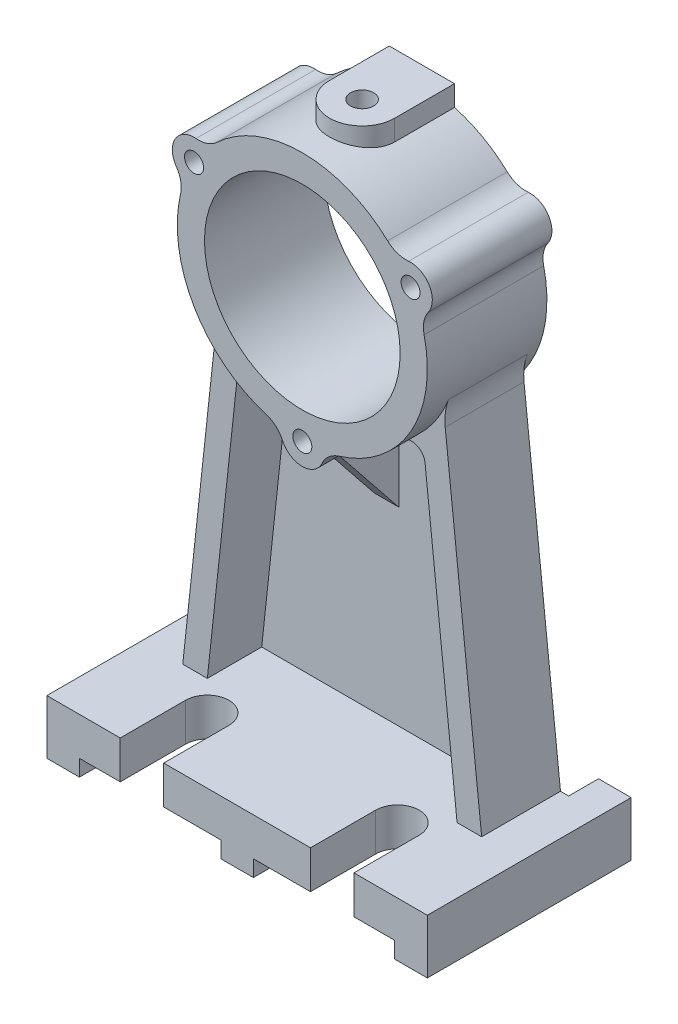
from build123d import *

# Parameters (mm, degrees)
EXTRUDE_1_DEPTH                  = 40
EXTRUDE_1_DEPTH_BACK             = 4
SKETCH_1_R                       = 46
EXTRUDE_START                    = -4
SKETCH_2_R                       = 8
EXTRUDE_2_DEPTH                  = 44
FILLET_1_R                       = 10
PATTERN_CIRCULAR_1_COUNT         = 3
FILLET_1_OF_PATTERN_CIRCULAR_1_R = 10
EXTRUDE_3_DEPTH                  = 52
EXTRUDE_4_DEPTH                  = 9
EXTRUDE_5_DEPTH                  = 20
FILLET_2_R                       = 20
FILLET_3_R                       = 5
RIB_1_REACH                      = 166.697
SKETCH_6_WALL_W                  = 367.279305732
SKETCH_6_WALL_H                  = 9
EXTRUDE_6_DEPTH                  = 64
EXTRUDE_6_DEPTH_BACK             = 11
SKETCH_8_W                       = 116
SKETCH_8_H                       = 11
CUT_EXTRUDE_1_DEPTH              = 64
SKETCH_9_R                       = 36
SKETCH_9_R_2                     = 3.5
CUT_EXTRUDE_2_DEPTH              = 64
HOLE_WIZARD_M10_1_REACH          = 239.276
HOLE_WIZARD_M10_1_BORE_R         = 4.25


with BuildPart() as part:
    # 草图1 → 凸台-拉伸1 (new, two sides: drawn at the far end of the back side and taken through both)
    with BuildSketch(Plane.XY.offset(-EXTRUDE_1_DEPTH_BACK)):
        Circle(SKETCH_1_R)
    extrude(amount=EXTRUDE_1_DEPTH + EXTRUDE_1_DEPTH_BACK)

    # 草图2 → 凸台-拉伸2 (add)
    with BuildSketch(Plane.XY.offset(EXTRUDE_START)):
        with Locations((0, -46)):
            Circle(SKETCH_2_R)
    extrude_2 = extrude(amount=EXTRUDE_2_DEPTH)

    # 圆角1
    fillet_1_edges = [part.edges().sort_by_distance(p)[0] for p in [
        (7.969696861, -45.304347826, 18),
        (-7.969696861, -45.304347826, 18),
    ]]
    fillet(fillet_1_edges, radius=FILLET_1_R)

    # 阵列(圆周)1: 凸台-拉伸2 ×3 about axis
    pattern_circular_1_axis = Axis((0, 0, 0), (0, 0, 1))
    for i in range(1, PATTERN_CIRCULAR_1_COUNT):
        add(extrude_2.rotate(pattern_circular_1_axis, i * 360 / PATTERN_CIRCULAR_1_COUNT))

    # 圆角1 of 阵列(圆周)1
    fillet_1_of_pattern_circular_1_edges = [part.edges().sort_by_distance(p)[0] for p in [
        (35.249867689, 29.554133855, 18),
        (43.21956455, 15.750213971, 18),
        (-43.21956455, 15.750213971, 18),
        (-35.249867689, 29.554133855, 18),
    ]]
    fillet(fillet_1_of_pattern_circular_1_edges, radius=FILLET_1_OF_PATTERN_CIRCULAR_1_R)

    # 草图3 → 凸台-拉伸3 (add)
    with BuildSketch(Plane(origin=(0, 0, 0), x_dir=(1, 0, 0), z_dir=(0, 1, 0))):
        with BuildLine():
            Line((-12, 4), (12, 4))
            Line((12, 4), (12, -18))
            ThreePointArc((12, -18), (0, -30), (-12, -18))
            Line((-12, -18), (-12, 4))
        make_face()
    extrude(amount=EXTRUDE_3_DEPTH)

    # 草图4 → 凸台-拉伸4 (add)
    with BuildSketch(Plane.XY):
        Polygon((-55, -150), (55, -150), (41, -20.856653615), (-41, -20.856653615), align=None)
    extrude(amount=EXTRUDE_4_DEPTH)

    # 草图5 → 凸台-拉伸5 (add)
    with BuildSketch(Plane.XY.offset(9)):
        Polygon((-41, -20.856653615), (-55, -150), (-45.947270441, -150), (-32.052422425, -21.826630695), align=None)
    extrude_5 = extrude(amount=EXTRUDE_5_DEPTH)

    # 镜向1: 凸台-拉伸5 across plane
    add(extrude_5.mirror(Plane(origin=(0, 0, 0), x_dir=(0, 0, 1), z_dir=(1, 0, 0))))

    # 圆角2
    fillet_2_edges = [part.edges().sort_by_distance(p)[0] for p in [
        (41, -20.856653615, 14.5),
        (-41, -20.856653615, 14.5),
    ]]
    fillet(fillet_2_edges, radius=FILLET_2_R)

    # 圆角3
    fillet_3_edges = [part.edges().sort_by_distance(p)[0] for p in [
        (-33.144192236, -31.897688333, 19),
        (33.144192236, -31.897688333, 19),
    ]]
    fillet(fillet_3_edges, radius=FILLET_3_R)

    # 草图6 wall → 筋1 (add, up to next)
    with BuildSketch(Plane(origin=(0, -68, 18.777260671), x_dir=(0, -0.780250226157, -0.625467492826), z_dir=(0, 0.625467492826, -0.780250226157)), mode=Mode.PRIVATE) as rib_1_sk1:
        Rectangle(SKETCH_6_WALL_W, SKETCH_6_WALL_H)
    rib_1_tool1 = extrude(rib_1_sk1.sketch, amount=RIB_1_REACH, mode=Mode.PRIVATE) - part.part
    add(rib_1_tool1.solids().sort_by_distance((0, -68, 18.777260671))[0])

    # 草图7 → 凸台-拉伸6 (add, two sides: drawn at the far end of the back side and taken through both)
    with BuildSketch(Plane.XY.offset(-EXTRUDE_6_DEPTH_BACK)):
        Polygon((-70, -150), (70, -150), (70, -170), (58, -170), (58, -164), (6, -164), (6, -170), (-6, -170), (-6, -164), (-58, -164), (-58, -170), (-70, -170), align=None)
    extrude(amount=EXTRUDE_6_DEPTH + EXTRUDE_6_DEPTH_BACK)

    # 草图8 → 切除-拉伸1 (cut)
    with BuildSketch(Plane(origin=(0, -150, 0), x_dir=(1, 0, 0), z_dir=(0, 1, 0))):
        with Locations((0, 5.5)):
            Rectangle(SKETCH_8_W, SKETCH_8_H)
        with BuildLine():
            Line((-43, -40), (-43, -64))
            Line((-43, -64), (-27, -64))
            Line((-27, -64), (-27, -40))
            ThreePointArc((-27, -40), (-35, -32), (-43, -40))
        make_face()
        with BuildLine():
            Line((43, -40), (43, -64))
            Line((43, -64), (27, -64))
            Line((27, -64), (27, -40))
            ThreePointArc((27, -40), (35, -32), (43, -40))
        make_face()
    extrude(amount=-CUT_EXTRUDE_1_DEPTH, mode=Mode.SUBTRACT)

    # 草图9 → 切除-拉伸2 (cut)
    with BuildSketch(Plane.XY.offset(40)):
        Circle(SKETCH_9_R)
        with Locations((-39.837168574, 23)):
            Circle(SKETCH_9_R_2)
        with Locations((39.837168574, 23)):
            Circle(SKETCH_9_R_2)
        with Locations((0, -46)):
            Circle(SKETCH_9_R_2)
    extrude(amount=-CUT_EXTRUDE_2_DEPTH, mode=Mode.SUBTRACT)

    # M10 螺纹孔1 bore (on position points) → M10 螺纹孔1 (cut, up to next)
    with BuildSketch(Plane(origin=(0, 52, 18), x_dir=(0, 0, 1), z_dir=(0, 1, 0)), mode=Mode.PRIVATE) as hole_wizard_m10_1_sk1:
        Circle(HOLE_WIZARD_M10_1_BORE_R)
    hole_wizard_m10_1_tool1 = extrude(hole_wizard_m10_1_sk1.sketch, amount=-HOLE_WIZARD_M10_1_REACH, mode=Mode.PRIVATE) & part.part
    add(hole_wizard_m10_1_tool1.solids().sort_by_distance((0, 52, 18))[0], mode=Mode.SUBTRACT)


solid = part.part
